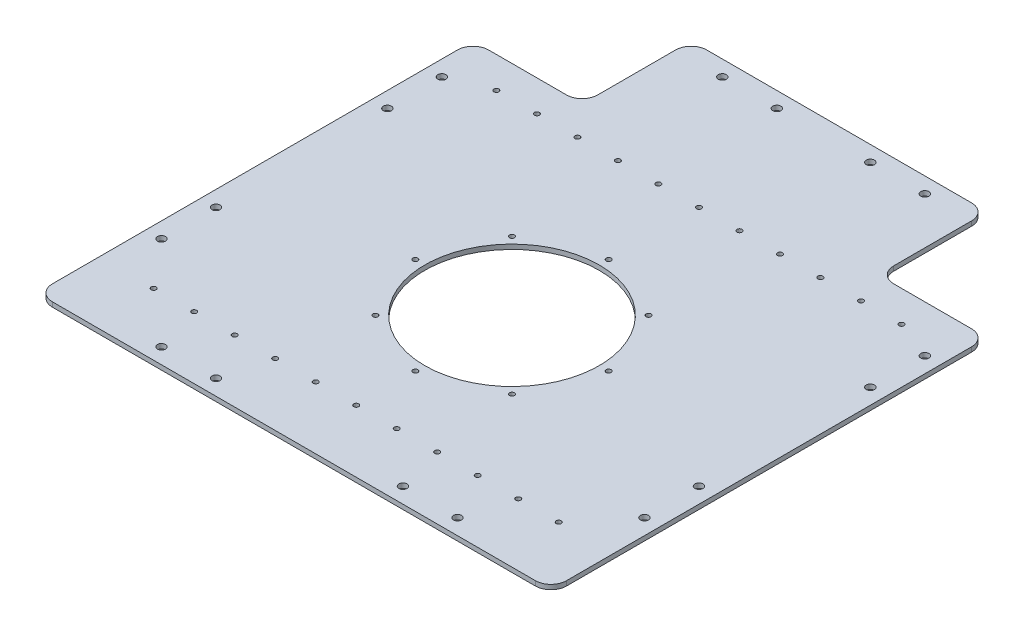
from build123d import *

# Parameters (mm, degrees)
SKETCH1_W           = 330
SKETCH1_H           = 280
SKETCH1_R           = 56
SKETCH1_W_2         = 190
SKETCH1_H_2         = 70
BOSS_EXTRUDE1_DEPTH = 3
FILLET1_R           = 10
SKETCH2_R           = 2.6
SKETCH2_R_2         = 1.6
CUT_EXTRUDE1_DEPTH  = 482.049893462


with BuildPart() as part:
    # Sketch1 → Boss-Extrude1 (new body)
    # profile 1 of 2: a face of its own
    with BuildSketch(Plane(origin=(0, 0, 0), x_dir=(1, 0, 0), z_dir=(0, 1, 0))):
        with Locations((165, 140)):
            Rectangle(SKETCH1_W, SKETCH1_H)
        with Locations(Location((165, 140, 0), (0, 0, 270))):
            Circle(SKETCH1_R, mode=Mode.SUBTRACT)
    # profile 2 of 2: a face of its own
    with BuildSketch(Plane(origin=(0, 0, 0), x_dir=(1, 0, 0), z_dir=(0, 1, 0))):
        with Locations((165, 315)):
            Rectangle(SKETCH1_W_2, SKETCH1_H_2)
    extrude(amount=BOSS_EXTRUDE1_DEPTH)

    # Fillet1
    fillet1_edges = [part.edges().sort_by_distance(p)[0] for p in [
        (0, 1.5, 0),
        (0, 1.5, -280),
        (70, 1.5, -280),
        (70, 1.5, -350),
        (260, 1.5, -350),
        (260, 1.5, -280),
        (330, 1.5, -280),
        (330, 1.5, 0),
    ]]
    fillet(fillet1_edges, radius=FILLET1_R)

    # Sketch2 → Cut-Extrude1 (cut, through all)
    with BuildSketch(Plane(origin=(0, 3, 0), x_dir=(1, 0, 0), z_dir=(0, 1, 0))):
        with Locations(Location((100, 340, 0), (0, 0, 270))):
            Circle(SKETCH2_R)
        with Locations(Location((230, 340, 0), (0, 0, 270))):
            Circle(SKETCH2_R)
        with Locations(Location((320, 250, 0), (0, 0, 270))):
            Circle(SKETCH2_R)
        with Locations(Location((320, 70, 0), (0, 0, 270))):
            Circle(SKETCH2_R)
        with Locations(Location((260, 10, 0), (0, 0, 270))):
            Circle(SKETCH2_R)
        with Locations(Location((10, 70, 0), (0, 0, 270))):
            Circle(SKETCH2_R)
        with Locations(Location((70, 10, 0), (0, 0, 270))):
            Circle(SKETCH2_R)
        with Locations(Location((10, 250, 0), (0, 0, 270))):
            Circle(SKETCH2_R)
        with Locations(Location((165, 202, 0), (0, 0, 270))):
            Circle(SKETCH2_R_2)
        with Locations(Location((208.840620434, 183.840620434, 0), (0, 0, 270))):
            Circle(SKETCH2_R_2)
        with Locations(Location((227, 140, 0), (0, 0, 270))):
            Circle(SKETCH2_R_2)
        with Locations(Location((208.840620434, 96.159379566, 0), (0, 0, 270))):
            Circle(SKETCH2_R_2)
        with Locations(Location((165, 78, 0), (0, 0, 270))):
            Circle(SKETCH2_R_2)
        with Locations(Location((121.159379566, 96.159379566, 0), (0, 0, 270))):
            Circle(SKETCH2_R_2)
        with Locations(Location((103, 140, 0), (0, 0, 270))):
            Circle(SKETCH2_R_2)
        with Locations(Location((121.159379566, 183.840620434, 0), (0, 0, 270))):
            Circle(SKETCH2_R_2)
        with Locations(Location((35, 260, 0), (0, 0, 270))):
            Circle(SKETCH2_R_2)
        with Locations(Location((61, 260, 0), (0, 0, 270))):
            Circle(SKETCH2_R_2)
        with Locations(Location((87, 260, 0), (0, 0, 270))):
            Circle(SKETCH2_R_2)
        with Locations(Location((113, 260, 0), (0, 0, 270))):
            Circle(SKETCH2_R_2)
        with Locations(Location((139, 260, 0), (0, 0, 270))):
            Circle(SKETCH2_R_2)
        with Locations(Location((165, 260, 0), (0, 0, 270))):
            Circle(SKETCH2_R_2)
        with Locations(Location((191, 260, 0), (0, 0, 270))):
            Circle(SKETCH2_R_2)
        with Locations(Location((217, 260, 0), (0, 0, 270))):
            Circle(SKETCH2_R_2)
        with Locations(Location((243, 260, 0), (0, 0, 270))):
            Circle(SKETCH2_R_2)
        with Locations(Location((269, 260, 0), (0, 0, 270))):
            Circle(SKETCH2_R_2)
        with Locations(Location((295, 260, 0), (0, 0, 270))):
            Circle(SKETCH2_R_2)
        with Locations(Location((35, 40, 0), (0, 0, 270))):
            Circle(SKETCH2_R_2)
        with Locations(Location((61, 40, 0), (0, 0, 270))):
            Circle(SKETCH2_R_2)
        with Locations(Location((87, 40, 0), (0, 0, 270))):
            Circle(SKETCH2_R_2)
        with Locations(Location((113, 40, 0), (0, 0, 270))):
            Circle(SKETCH2_R_2)
        with Locations(Location((139, 40, 0), (0, 0, 270))):
            Circle(SKETCH2_R_2)
        with Locations(Location((165, 40, 0), (0, 0, 270))):
            Circle(SKETCH2_R_2)
        with Locations(Location((191, 40, 0), (0, 0, 270))):
            Circle(SKETCH2_R_2)
        with Locations(Location((217, 40, 0), (0, 0, 270))):
            Circle(SKETCH2_R_2)
        with Locations(Location((243, 40, 0), (0, 0, 270))):
            Circle(SKETCH2_R_2)
        with Locations(Location((269, 40, 0), (0, 0, 270))):
            Circle(SKETCH2_R_2)
        with Locations(Location((295, 40, 0), (0, 0, 270))):
            Circle(SKETCH2_R_2)
        with Locations(Location((10, 215, 0), (0, 0, 270))):
            Circle(SKETCH2_R)
        with Locations(Location((10, 105, 0), (0, 0, 270))):
            Circle(SKETCH2_R)
        with Locations(Location((105, 10, 0), (0, 0, 270))):
            Circle(SKETCH2_R)
        with Locations(Location((225, 10, 0), (0, 0, 270))):
            Circle(SKETCH2_R)
        with Locations(Location((320, 105, 0), (0, 0, 270))):
            Circle(SKETCH2_R)
        with Locations(Location((320, 215, 0), (0, 0, 270))):
            Circle(SKETCH2_R)
        with Locations(Location((135, 340, 0), (0, 0, 270))):
            Circle(SKETCH2_R)
        with Locations(Location((195, 340, 0), (0, 0, 270))):
            Circle(SKETCH2_R)
    extrude(amount=-CUT_EXTRUDE1_DEPTH, mode=Mode.SUBTRACT)


solid = part.part
